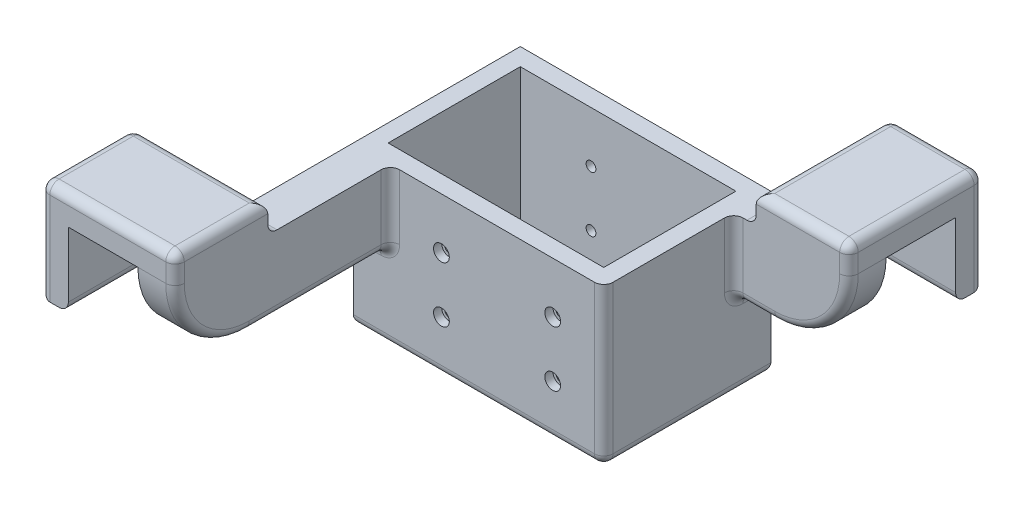
from build123d import *

# Parameters (mm, degrees)
SKETCH2_W             = 54.022158158
SKETCH2_H             = 36.022158158
SKETCH2_W_2           = 46.5
SKETCH2_H_2           = 28.5
BOSS_EXTRUDE1_DEPTH   = 34.036
SKETCH11_R            = 1.049999932
CUT_EXTRUDE1_DEPTH    = 74.310563675
BOSS_EXTRUDE3_DEPTH   = 6
BOSS_EXTRUDE3_2_DEPTH = 6
SKETCH19_W            = 8
SKETCH19_H            = 46.439396398
SKETCH19_W_2          = 24.86121623
SKETCH19_H_2          = 8
SKETCH19_W_3          = 6
SKETCH19_H_3          = 20
SKETCH19_W_4          = 20
SKETCH19_H_4          = 6
BOSS_EXTRUDE10_DEPTH  = 16
FILLET6_R             = 16
FILLET7_R             = 2
SKETCH21_R            = 1.7
CUT_EXTRUDE2_DEPTH    = 1.761079079
CUT_EXTRUDE3_START    = -1.761079079
SKETCH22_R            = 1.7
CUT_EXTRUDE3_DEPTH    = 1.761079079


with BuildPart() as part:
    # Sketch2 → Boss-Extrude1 (new body)
    with BuildSketch(Plane(origin=(0, 0, 0), x_dir=(1, 0, 0), z_dir=(0, 1, 0))):
        with Locations((27.011079079, -18.011079079)):
            Rectangle(SKETCH2_W, SKETCH2_H)
        with Locations((27.011079079, -18.011079079)):
            Rectangle(SKETCH2_W_2, SKETCH2_H_2, mode=Mode.SUBTRACT)
    extrude(amount=-BOSS_EXTRUDE1_DEPTH)

    # Sketch11 → Cut-Extrude1 (cut, through all)
    with BuildSketch(Plane(origin=(0, 0, 0), x_dir=(-1, 0, 0), z_dir=(0, 0, -1))):
        with Locations((-19.011079079, -11)):
            Circle(SKETCH11_R)
        with Locations((-19.011079079, -23)):
            Circle(SKETCH11_R)
        with Locations((-43.01107908, -11)):
            Circle(SKETCH11_R)
        with Locations((-43.011079079, -23)):
            Circle(SKETCH11_R)
    extrude(amount=-CUT_EXTRUDE1_DEPTH, mode=Mode.SUBTRACT)



with BuildPart() as body_2:
    # Sketch12 → Boss-Extrude3 (new body)
    with BuildSketch(Plane(origin=(0, 0, 0), x_dir=(1, 0, 0), z_dir=(0, 1, 0))):
        Polygon((0, -82.461554556), (-15, -82.461554556), (-21, -82.461554556), (-21, -62.461554556), (-15, -62.461554556), (0, -62.461554556), (8, -62.461554556), (8, -82.461554556), align=None)
    extrude(amount=BOSS_EXTRUDE3_DEPTH)


with BuildPart() as body_3:
    # Sketch12 → Boss-Extrude3 2 (new body)
    with BuildSketch(Plane(origin=(0, 0, 0), x_dir=(1, 0, 0), z_dir=(0, 1, 0))):
        Polygon((58.883374388, -8), (58.883374388, 0), (58.883374388, 15), (58.883374388, 21), (78.883374388, 21), (78.883374388, 15), (78.883374388, 0), (78.883374388, -8), align=None)
    extrude(amount=BOSS_EXTRUDE3_2_DEPTH)


with BuildPart() as part_1:
    add(part.part)

    add(body_2.part)  # Boss-Extrude10 merges body 2

    add(body_3.part)  # Boss-Extrude10 merges body 3
    # Sketch19 → Boss-Extrude10 (add)
    with BuildSketch(Plane(origin=(0, 0, 0), x_dir=(-1, 0, 0), z_dir=(0, 1, 0))):
        with Locations((-4, 59.241856357)):
            Rectangle(SKETCH19_W, SKETCH19_H)
        with Locations((-66.452766273, 4)):
            Rectangle(SKETCH19_W_2, SKETCH19_H_2)
        with Locations((18, 72.461554556)):
            Rectangle(SKETCH19_W_3, SKETCH19_H_3)
        with Locations((-68.883374388, -18)):
            Rectangle(SKETCH19_W_4, SKETCH19_H_4)
    extrude(amount=-BOSS_EXTRUDE10_DEPTH)

    # Fillet6
    fillet6_edges = [part_1.edges().sort_by_distance(p)[0] for p in [
        (78.883374388, -16, 4),
        (4, -16, 82.461554556),
    ]]
    fillet(fillet6_edges, radius=FILLET6_R)

    # Fillet7
    fillet7_edges = [part_1.edges().sort_by_distance(p)[0] for p in [
        (-21, -16, 72.461554556),
        (-15, -16, 72.461554556),
        (68.883374388, -16, -21),
        (68.883374388, -16, -15),
        (78.883374388, 3, 8),
        (54.022158158, -34.036, 18.011079079),
        (74.197082887, -11.313708499, 8),
        (8, 3, 82.461554556),
        (8, -16, 51.241856357),
        (8, -11.313708499, 77.775263055),
        (27.011079079, -34.036, 0),
        (0, -34.036, 18.011079079),
        (8, -8, 36.022158158),
        (4, -16, 36.022158158),
        (4, 0, 62.461554556),
        (-21, -5, 62.461554556),
        (-21, -5, 82.461554556),
        (8, 6, 72.461554556),
        (-6.5, 6, 62.461554556),
        (-21, 6, 72.461554556),
        (-6.5, 6, 82.461554556),
        (54.022158158, -17.018, 36.022158158),
        (58.452766273, -16, 8),
        (54.022158158, -16, 4),
        (54.022158158, -8, 8),
        (27.011079079, -34.036, 36.022158158),
        (78.883374388, -5, -21),
        (58.883374388, 0, 4),
        (58.883374388, -5, -21),
        (68.883374388, 6, 8),
        (78.883374388, 6, -6.5),
        (68.883374388, 6, -21),
        (58.883374388, 6, -6.5),
    ]]
    fillet(fillet7_edges, radius=FILLET7_R)

    # Sketch21 → Cut-Extrude2 (cut)
    with BuildSketch(Plane.XY.offset(36.022158158)):
        with Locations((19.011079079, -11)):
            Circle(SKETCH21_R)
        with Locations((43.01107908, -11)):
            Circle(SKETCH21_R)
        with Locations((19.011079079, -23)):
            Circle(SKETCH21_R)
        with Locations((43.011079079, -23)):
            Circle(SKETCH21_R)
    extrude(amount=-CUT_EXTRUDE2_DEPTH, mode=Mode.SUBTRACT)

    # Sketch22 → Cut-Extrude3 (cut)
    with BuildSketch(Plane(origin=(0, 0, 0), x_dir=(-1, 0, 0), z_dir=(0, 0, -1)).offset(CUT_EXTRUDE3_START)):
        with Locations(Location((-43.01107908, -11, 0), (0, 0, 180))):
            Circle(SKETCH22_R)
        with Locations(Location((-43.011079079, -23, 0), (0, 0, 180))):
            Circle(SKETCH22_R)
        with Locations(Location((-19.011079079, -11, 0), (0, 0, 180))):
            Circle(SKETCH22_R)
        with Locations(Location((-19.011079079, -23, 0), (0, 0, 180))):
            Circle(SKETCH22_R)
    extrude(amount=CUT_EXTRUDE3_DEPTH, mode=Mode.SUBTRACT)


solid = part_1.part
